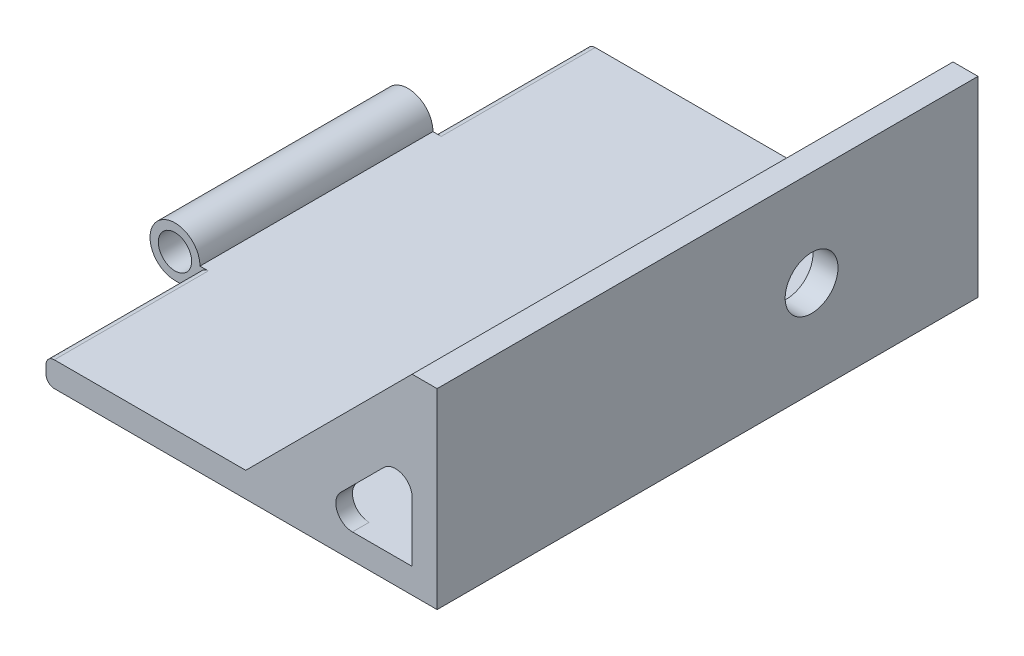
from build123d import *

# Parameters (mm, degrees)
SKETCH1_W           = 50
SKETCH1_H           = 65
BOSS_EXTRUDE1_DEPTH = 3
SKETCH2_W           = 3
SKETCH2_H           = 3
CUT_EXTRUDE1_DEPTH  = 18.5
SKETCH3_W           = 3
SKETCH3_H           = 3
CUT_EXTRUDE2_DEPTH  = 18.5
SKETCH4_R           = 3
BOSS_EXTRUDE2_DEPTH = 28
SKETCH5_R           = 2
CUT_EXTRUDE3_DEPTH  = 28
FILLET1_R           = 1
SKETCH6_W           = 3
SKETCH6_H           = 65
BOSS_EXTRUDE3_DEPTH = 20
BOSS_EXTRUDE4_DEPTH = 2
BOSS_EXTRUDE5_DEPTH = 2
CUT_EXTRUDE4_DEPTH  = 82
FILLET2_R           = 2
SKETCH10_R          = 3.175
CUT_EXTRUDE5_DEPTH  = 82


with BuildPart() as part:
    # Sketch1 → Boss-Extrude1 (new body)
    with BuildSketch(Plane(origin=(0, 0, 0), x_dir=(1, 0, 0), z_dir=(0, 1, 0))):
        Rectangle(SKETCH1_W, SKETCH1_H)
    extrude(amount=BOSS_EXTRUDE1_DEPTH)

    # Sketch2 → Cut-Extrude1 (cut)
    with BuildSketch(Plane.XY.offset(32.5)):
        with Locations((-23.5, 1.5)):
            Rectangle(SKETCH2_W, SKETCH2_H)
    extrude(amount=-CUT_EXTRUDE1_DEPTH, mode=Mode.SUBTRACT)

    # Sketch3 → Cut-Extrude2 (cut)
    with BuildSketch(Plane(origin=(0, 0, -32.5), x_dir=(-1, 0, 0), z_dir=(0, 0, -1))):
        with Locations((23.5, 1.5)):
            Rectangle(SKETCH3_W, SKETCH3_H)
    extrude(amount=-CUT_EXTRUDE2_DEPTH, mode=Mode.SUBTRACT)

    # Sketch4 → Boss-Extrude2 (add)
    with BuildSketch(Plane.XY.offset(14)):
        with Locations((-25, 3)):
            Circle(SKETCH4_R)
    extrude(amount=-BOSS_EXTRUDE2_DEPTH)

    # Sketch5 → Cut-Extrude3 (cut)
    with BuildSketch(Plane.XY.offset(14)):
        with Locations((-25, 3)):
            Circle(SKETCH5_R)
    extrude(amount=-CUT_EXTRUDE3_DEPTH, mode=Mode.SUBTRACT)

    # Fillet1
    fillet1_edges = [part.edges().sort_by_distance(p)[0] for p in [
        (-22, 3, 23.25),
        (-22, 0, 23.25),
        (-22, 0, -23.25),
        (-22, 3, -23.25),
    ]]
    fillet(fillet1_edges, radius=FILLET1_R)

    # Sketch6 → Boss-Extrude3 (add)
    with BuildSketch(Plane(origin=(0, 3, 0), x_dir=(1, 0, 0), z_dir=(0, 1, 0))):
        with Locations((23.5, 0)):
            Rectangle(SKETCH6_W, SKETCH6_H)
    extrude(amount=BOSS_EXTRUDE3_DEPTH)

    # Sketch7 → Boss-Extrude4 (add)
    with BuildSketch(Plane.XY.offset(32.5)):
        Polygon((22, 23), (22, 3), (2, 3), align=None)
    extrude(amount=-BOSS_EXTRUDE4_DEPTH)

    # Sketch8 → Boss-Extrude5 (add)
    with BuildSketch(Plane(origin=(0, 0, -32.5), x_dir=(-1, 0, 0), z_dir=(0, 0, -1))):
        Polygon((-22, 23), (-2, 3), (-22, 3), align=None)
    extrude(amount=-BOSS_EXTRUDE5_DEPTH)

    # Sketch9 → Cut-Extrude4 (cut)
    with BuildSketch(Plane.XY.offset(32.5)):
        Polygon((22, 15), (22, 3), (10, 3), align=None)
    extrude(amount=-CUT_EXTRUDE4_DEPTH, mode=Mode.SUBTRACT)

    # Fillet2
    fillet2_edges = [part.edges().sort_by_distance(p)[0] for p in [
        (10, 3, -31.5),
        (22, 15, -31.5),
        (10, 3, 31.5),
        (22, 15, 31.5),
    ]]
    fillet(fillet2_edges, radius=FILLET2_R)

    # Sketch10 → Cut-Extrude5 (cut)
    with BuildSketch(Plane(origin=(25, 0, 0), x_dir=(0, 0, -1), z_dir=(1, 0, 0))):
        with Locations((12.5, 11.5)):
            Circle(SKETCH10_R)
    extrude(amount=-CUT_EXTRUDE5_DEPTH, mode=Mode.SUBTRACT)


solid = part.part
